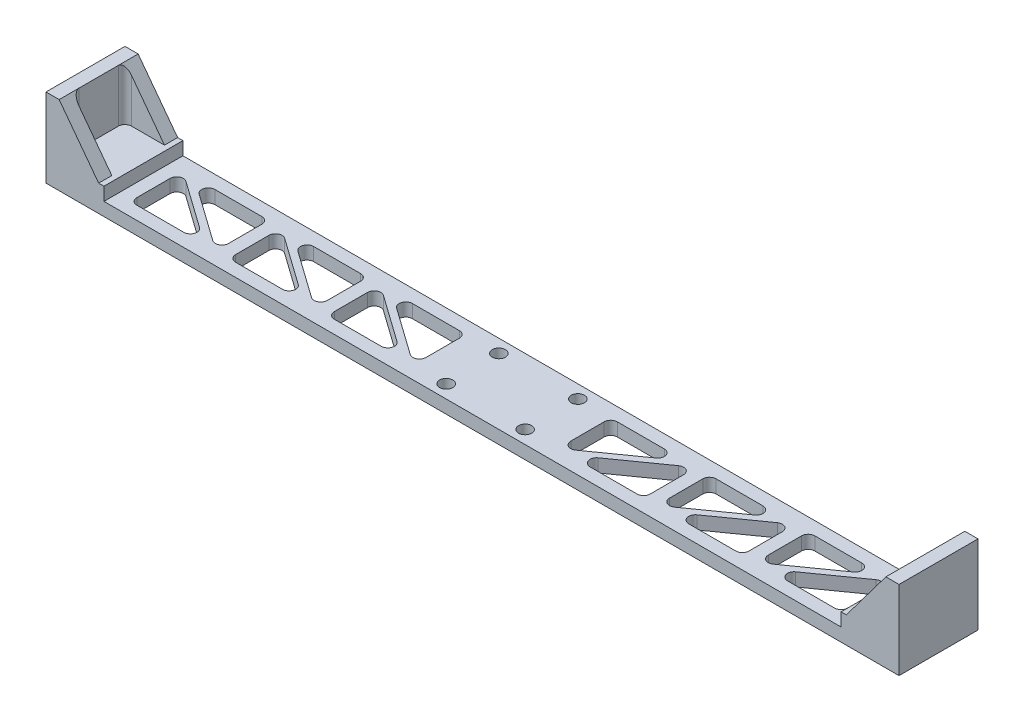
from build123d import *

# Parameters (mm, degrees)
SKETCH1_W                   = 38.1
SKETCH1_H                   = 38.1
BOSS_EXTRUDE1_DEPTH         = 205.74
CUT_EXTRUDE1_REACH          = 212.103
CUT_EXTRUDE2_DEPTH          = 25.4
F_1_4_0_25_DIAMETER_HOLE1_D = 6.35
SKETCH10_W                  = 355.6
SKETCH10_H                  = 38.1
CUT_EXTRUDE3_DEPTH          = 6.35
CUT_EXTRUDE4_REACH          = 211.045
FILLET1_R                   = 3.175
FILLET1_OF_MIRROR1_R        = 3.175


with BuildPart() as part:
    # Sketch1 → Boss-Extrude1 (new, symmetric)
    with BuildSketch(Plane(origin=(0, 0, 0), x_dir=(0, 0, -1), z_dir=(1, 0, 0))):
        Rectangle(SKETCH1_W, SKETCH1_H)
    extrude(amount=BOSS_EXTRUDE1_DEPTH, both=True)

    # Sketch3 → Cut-Extrude1 (cut, up to next)
    with BuildSketch(Plane.XY.offset(19.05), mode=Mode.PRIVATE) as cut_extrude1_sk1:
        Polygon((-199.39, 19.05), (-180.34, -6.35), (180.34, -6.35), (199.39, 19.05), align=None)
    cut_extrude1_tool1 = extrude(cut_extrude1_sk1.sketch, amount=-CUT_EXTRUDE1_REACH, mode=Mode.PRIVATE) & part.part
    add(cut_extrude1_tool1.solids().sort_by_distance((0, 6.562375, 19.05))[0], mode=Mode.SUBTRACT)

    # Sketch4 → Cut-Extrude2 (cut)
    with BuildSketch(Plane(origin=(0, 19.05, 0), x_dir=(1, 0, 0), z_dir=(0, 1, 0))):
        with BuildLine():
            Line((-199.39, 9.525), (-199.39, -9.525))
            ThreePointArc((-199.39, -9.525), (-198.46006403, -11.77006403), (-196.215, -12.7))
            Line((-196.215, -12.7), (-148.59, -12.7))
            Line((-148.59, -12.7), (-148.59, 12.7))
            Line((-148.59, 12.7), (-196.215, 12.7))
            ThreePointArc((-196.215, 12.7), (-198.46006403, 11.77006403), (-199.39, 9.525))
        make_face()
        with BuildLine():
            Line((148.59, 12.7), (196.215, 12.7))
            ThreePointArc((196.215, 12.7), (198.46006403, 11.77006403), (199.39, 9.525))
            Line((199.39, 9.525), (199.39, -9.525))
            ThreePointArc((199.39, -9.525), (198.46006403, -11.77006403), (196.215, -12.7))
            Line((196.215, -12.7), (148.59, -12.7))
            Line((148.59, -12.7), (148.59, 12.7))
        make_face()
    extrude(amount=-CUT_EXTRUDE2_DEPTH, mode=Mode.SUBTRACT)

    # 1/4 (0.25) Diameter Hole1 (through all)
    with Locations(Plane(origin=(0, -6.35, 0), x_dir=(1, 0, 0), z_dir=(0, 1, 0))):
        with Locations((19.05, -12.7), (-19.05, 12.7), (-19.05, -12.7), (19.05, 12.7)):
            Hole(F_1_4_0_25_DIAMETER_HOLE1_D / 2)

    # Sketch10 → Cut-Extrude3 (cut)
    with BuildSketch(Plane(origin=(0, -6.35, 0), x_dir=(1, 0, 0), z_dir=(0, 1, 0))):
        Rectangle(SKETCH10_W, SKETCH10_H)
    extrude(amount=-CUT_EXTRUDE3_DEPTH, mode=Mode.SUBTRACT)

    # Sketch11 → Cut-Extrude4 (cut, up to next)
    with BuildSketch(Plane(origin=(0, -12.7, 0), x_dir=(1, 0, 0), z_dir=(0, 1, 0)), mode=Mode.PRIVATE) as cut_extrude4_sk1:
        Polygon((-171.45, 12.7), (-171.45, -12.7), (-135.660813869, -12.7), align=None)
    cut_extrude4_tool1 = extrude(cut_extrude4_sk1.sketch, amount=-CUT_EXTRUDE4_REACH, mode=Mode.PRIVATE) & part.part
    # Sketch11 → Cut-Extrude4 (cut, up to next)
    with BuildSketch(Plane(origin=(0, -12.7, 0), x_dir=(1, 0, 0), z_dir=(0, 1, 0)), mode=Mode.PRIVATE) as cut_extrude4_sk2:
        Polygon((-165.964186131, 12.7), (-130.175, -12.7), (-130.175, 12.7), align=None)
    cut_extrude4_tool2 = extrude(cut_extrude4_sk2.sketch, amount=-CUT_EXTRUDE4_REACH, mode=Mode.PRIVATE) & part.part
    # Sketch11 → Cut-Extrude4 (cut, up to next)
    with BuildSketch(Plane(origin=(0, -12.7, 0), x_dir=(1, 0, 0), z_dir=(0, 1, 0)), mode=Mode.PRIVATE) as cut_extrude4_sk3:
        Polygon((-123.825, 12.7), (-123.825, -12.7), (-88.035813869, -12.7), align=None)
    cut_extrude4_tool3 = extrude(cut_extrude4_sk3.sketch, amount=-CUT_EXTRUDE4_REACH, mode=Mode.PRIVATE) & part.part
    # Sketch11 → Cut-Extrude4 (cut, up to next)
    with BuildSketch(Plane(origin=(0, -12.7, 0), x_dir=(1, 0, 0), z_dir=(0, 1, 0)), mode=Mode.PRIVATE) as cut_extrude4_sk4:
        Polygon((-118.339186131, 12.7), (-82.55, -12.7), (-82.55, 12.7), align=None)
    cut_extrude4_tool4 = extrude(cut_extrude4_sk4.sketch, amount=-CUT_EXTRUDE4_REACH, mode=Mode.PRIVATE) & part.part
    # Sketch11 → Cut-Extrude4 (cut, up to next)
    with BuildSketch(Plane(origin=(0, -12.7, 0), x_dir=(1, 0, 0), z_dir=(0, 1, 0)), mode=Mode.PRIVATE) as cut_extrude4_sk5:
        Polygon((-76.2, 12.7), (-76.2, -12.7), (-40.410813869, -12.7), align=None)
    cut_extrude4_tool5 = extrude(cut_extrude4_sk5.sketch, amount=-CUT_EXTRUDE4_REACH, mode=Mode.PRIVATE) & part.part
    # Sketch11 → Cut-Extrude4 (cut, up to next)
    with BuildSketch(Plane(origin=(0, -12.7, 0), x_dir=(1, 0, 0), z_dir=(0, 1, 0)), mode=Mode.PRIVATE) as cut_extrude4_sk6:
        Polygon((-70.714186131, 12.7), (-34.925, -12.7), (-34.925, 12.7), align=None)
    cut_extrude4_tool6 = extrude(cut_extrude4_sk6.sketch, amount=-CUT_EXTRUDE4_REACH, mode=Mode.PRIVATE) & part.part
    cut_extrude4_1 = cut_extrude4_tool1.solids().sort_by_distance((-159.520271, -12.7, 4.233333))[0]
    add(cut_extrude4_1, mode=Mode.SUBTRACT)
    cut_extrude4_2 = cut_extrude4_tool2.solids().sort_by_distance((-142.104729, -12.7, -4.233333))[0]
    add(cut_extrude4_2, mode=Mode.SUBTRACT)
    cut_extrude4_3 = cut_extrude4_tool3.solids().sort_by_distance((-111.895271, -12.7, 4.233333))[0]
    add(cut_extrude4_3, mode=Mode.SUBTRACT)
    cut_extrude4_4 = cut_extrude4_tool4.solids().sort_by_distance((-94.479729, -12.7, -4.233333))[0]
    add(cut_extrude4_4, mode=Mode.SUBTRACT)
    cut_extrude4_5 = cut_extrude4_tool5.solids().sort_by_distance((-64.270271, -12.7, 4.233333))[0]
    add(cut_extrude4_5, mode=Mode.SUBTRACT)
    cut_extrude4_6 = cut_extrude4_tool6.solids().sort_by_distance((-46.854729, -12.7, -4.233333))[0]
    add(cut_extrude4_6, mode=Mode.SUBTRACT)
    cut_extrude4 = cut_extrude4_1 + cut_extrude4_2 + cut_extrude4_3 + cut_extrude4_4 + cut_extrude4_5 + cut_extrude4_6  # Cut-Extrude4 as one shape, for the pattern or mirror that repeats it

    # Fillet1
    fillet1_edges = [part.edges().sort_by_distance(p)[0] for p in [
        (-171.45, -15.875, -12.7),
        (-135.660813869, -15.875, 12.7),
        (-171.45, -15.875, 12.7),
        (-165.964186131, -15.875, -12.7),
        (-130.175, -15.875, -12.7),
        (-130.175, -15.875, 12.7),
        (-123.825, -15.875, -12.7),
        (-88.035813869, -15.875, 12.7),
        (-123.825, -15.875, 12.7),
        (-118.339186131, -15.875, -12.7),
        (-82.55, -15.875, -12.7),
        (-82.55, -15.875, 12.7),
        (-76.2, -15.875, -12.7),
        (-40.410813869, -15.875, 12.7),
        (-76.2, -15.875, 12.7),
        (-70.714186131, -15.875, -12.7),
        (-34.925, -15.875, -12.7),
        (-34.925, -15.875, 12.7),
    ]]
    fillet(fillet1_edges, radius=FILLET1_R)

    # Mirror1: Cut-Extrude4 across plane
    add(cut_extrude4.mirror(Plane(origin=(0, 0, 0), x_dir=(0, 0, 1), z_dir=(1, 0, 0))), mode=Mode.SUBTRACT)

    # Fillet1 of Mirror1
    fillet1_of_mirror1_edges = [part.edges().sort_by_distance(p)[0] for p in [
        (171.45, -15.875, -12.7),
        (135.660813869, -15.875, 12.7),
        (171.45, -15.875, 12.7),
        (165.964186131, -15.875, -12.7),
        (130.175, -15.875, -12.7),
        (130.175, -15.875, 12.7),
        (123.825, -15.875, -12.7),
        (88.035813869, -15.875, 12.7),
        (123.825, -15.875, 12.7),
        (118.339186131, -15.875, -12.7),
        (82.55, -15.875, -12.7),
        (82.55, -15.875, 12.7),
        (76.2, -15.875, -12.7),
        (40.410813869, -15.875, 12.7),
        (76.2, -15.875, 12.7),
        (70.714186131, -15.875, -12.7),
        (34.925, -15.875, -12.7),
        (34.925, -15.875, 12.7),
    ]]
    fillet(fillet1_of_mirror1_edges, radius=FILLET1_OF_MIRROR1_R)


solid = part.part
